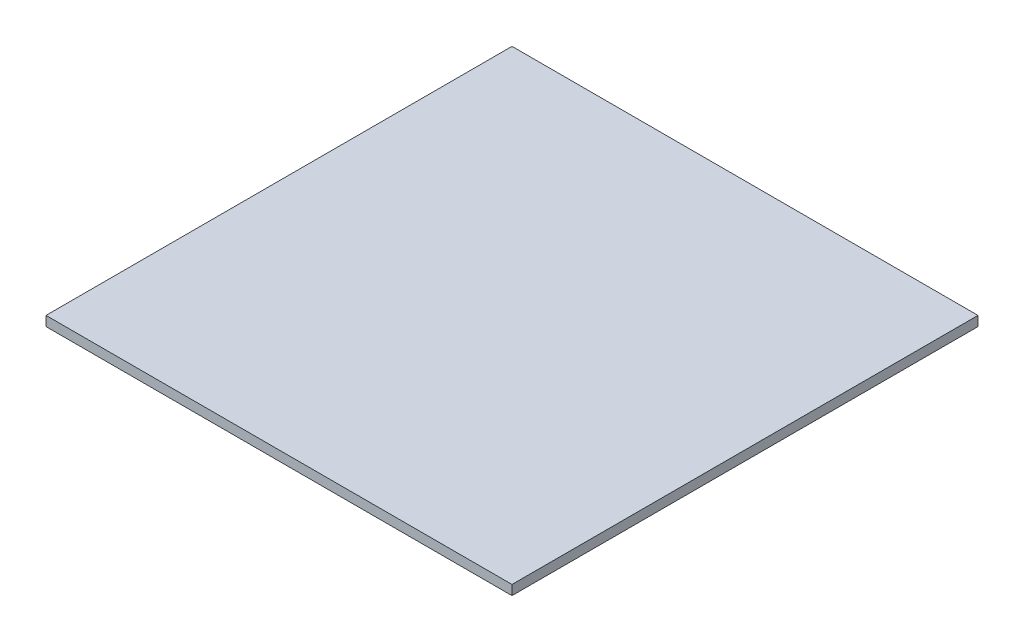
from build123d import *

# Parameters (mm, degrees)
SKETCH2_W           = 304.8
SKETCH2_H           = 304.8
BOSS_EXTRUDE1_DEPTH = 6.35


with BuildPart() as part:
    # Sketch2 → Boss-Extrude1 (new body)
    with BuildSketch(Plane(origin=(0, 0, 0), x_dir=(1, 0, 0), z_dir=(0, 1, 0))):
        Rectangle(SKETCH2_W, SKETCH2_H)
    extrude(amount=BOSS_EXTRUDE1_DEPTH)


solid = part.part
